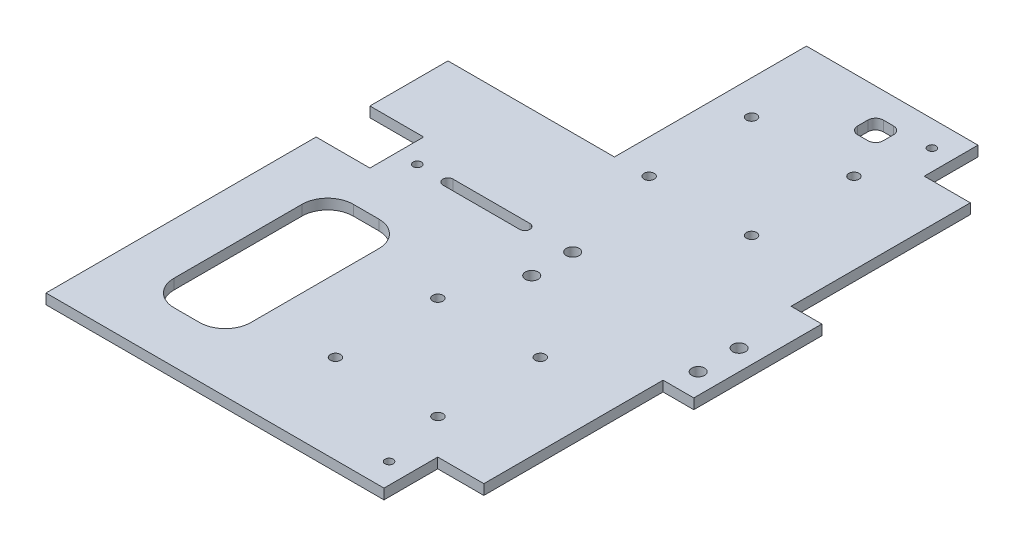
from build123d import *

# Parameters (mm, degrees)
SKETCH1_W           = 162
SKETCH1_H           = 232
BOSS_EXTRUDE1_DEPTH = 4
SKETCH4_W           = 30
SKETCH4_H           = 21
SKETCH4_W_2         = 21
CUT_EXTRUDE3_DEPTH  = 148.108803272
SKETCH5_R           = 1.599999999
SKETCH5_R_2         = 1.600000001
SKETCH5_R_3         = 1.6
SKETCH5_R_4         = 2
CUT_EXTRUDE4_DEPTH  = 148.108803272
SKETCH7_W           = 65
SKETCH7_H           = 75
CUT_EXTRUDE6_DEPTH  = 148.108803272
CUT_EXTRUDE7_DEPTH  = 148.108803272
CUT_EXTRUDE8_DEPTH  = 148.108803272
SKETCH10_R          = 2.5
CUT_EXTRUDE9_DEPTH  = 148.108803272
CUT_EXTRUDE10_DEPTH = 4
SKETCH12_W          = 12
SKETCH12_H          = 70
CUT_EXTRUDE11_DEPTH = 4


with BuildPart() as part:
    # Sketch1 → Boss-Extrude1 (new body)
    with BuildSketch(Plane(origin=(0, 0, 0), x_dir=(1, 0, 0), z_dir=(0, 1, 0))):
        with Locations((4, 4)):
            Rectangle(SKETCH1_W, SKETCH1_H)
    extrude(amount=BOSS_EXTRUDE1_DEPTH)

    # Sketch4 → Cut-Extrude3 (cut, through all)
    with BuildSketch(Plane(origin=(0, 4, 0), x_dir=(1, 0, 0), z_dir=(0, 1, 0))):
        with Locations((70, 109.5)):
            Rectangle(SKETCH4_W, SKETCH4_H)
        with Locations((-66.5, 4)):
            Rectangle(SKETCH4_W_2, SKETCH4_H)
        with Locations((70, -101.5)):
            Rectangle(SKETCH4_W, SKETCH4_H)
    extrude(amount=-CUT_EXTRUDE3_DEPTH, mode=Mode.SUBTRACT)

    # Sketch5 → Cut-Extrude4 (cut, through all)
    with BuildSketch(Plane.XZ):
        with Locations(Location((-48.000025976, -4, 0), (0, 0, 270))):
            Circle(SKETCH5_R)
        with Locations(Location((46.999999998, -109.999999999, 0), (0, 0, 270))):
            Circle(SKETCH5_R_2)
        with Locations(Location((46.999999999, 101.999999999, 0), (0, 0, 270))):
            Circle(SKETCH5_R_3)
        with Locations(Location((41.3, 37.25, 0), (0, 0, 270))):
            Circle(SKETCH5_R_4)
        with Locations(Location((41.3, 77.25, 0), (0, 0, 270))):
            Circle(SKETCH5_R_4)
        with Locations(Location((1.3, 37.25, 0), (0, 0, 270))):
            Circle(SKETCH5_R_4)
        with Locations(Location((1.3, 77.25, 0), (0, 0, 270))):
            Circle(SKETCH5_R_4)
        with Locations(Location((41.3, -45.25, 0), (0, 0, 270))):
            Circle(SKETCH5_R_4)
        with Locations(Location((1.3, -45.25, 0), (0, 0, 270))):
            Circle(SKETCH5_R_4)
        with Locations(Location((1.3, -85.25, 0), (0, 0, 270))):
            Circle(SKETCH5_R_4)
        with Locations(Location((41.3, -85.25, 0), (0, 0, 270))):
            Circle(SKETCH5_R_4)
    extrude(amount=-CUT_EXTRUDE4_DEPTH, mode=Mode.SUBTRACT)

    # Sketch7 → Cut-Extrude6 (cut, through all)
    with BuildSketch(Plane.XZ):
        with Locations((-44.5, -82.5)):
            Rectangle(SKETCH7_W, SKETCH7_H)
    extrude(amount=-CUT_EXTRUDE6_DEPTH, mode=Mode.SUBTRACT)

    # Sketch8 → Cut-Extrude7 (cut, through all)
    with BuildSketch(Plane.XZ):
        with BuildLine():
            Line((-47, 92), (-37, 92))
            ThreePointArc((-37, 92), (-29.928932188, 89.071067812), (-27, 82))
            Line((-27, 82), (-27, 32))
            ThreePointArc((-27, 32), (-29.928932188, 24.928932188), (-37, 22))
            Line((-37, 22), (-47, 22))
            ThreePointArc((-47, 22), (-54.071067812, 24.928932188), (-57, 32))
            Line((-57, 32), (-57, 82))
            ThreePointArc((-57, 82), (-54.071067812, 89.071067812), (-47, 92))
        make_face()
    extrude(amount=-CUT_EXTRUDE7_DEPTH, mode=Mode.SUBTRACT)

    # Sketch9 → Cut-Extrude8 (cut, through all)
    with BuildSketch(Plane(origin=(0, 4, 0), x_dir=(1, 0, 0), z_dir=(0, 1, 0))):
        with BuildLine():
            Line((28, 100), (32, 100))
            ThreePointArc((32, 100), (34.121320344, 100.878679656), (35, 103))
            Line((35, 103), (35, 107))
            ThreePointArc((35, 107), (34.121320344, 109.121320344), (32, 110))
            Line((32, 110), (28, 110))
            ThreePointArc((28, 110), (25.878679656, 109.121320344), (25, 107))
            Line((25, 107), (25, 103))
            ThreePointArc((25, 103), (25.878679656, 100.878679656), (28, 100))
        make_face()
    extrude(amount=-CUT_EXTRUDE8_DEPTH, mode=Mode.SUBTRACT)

    # Sketch10 → Cut-Extrude9 (cut, through all)
    with BuildSketch(Plane(origin=(0, 4, 0), x_dir=(1, 0, 0), z_dir=(0, 1, 0))):
        with Locations(Location((12, -11.291947097, 0), (0, 0, 270))):
            Circle(SKETCH10_R)
        with Locations(Location((12, 4.708052903, 0), (0, 0, 270))):
            Circle(SKETCH10_R)
        with Locations(Location((77, 4.708052903, 0), (0, 0, 270))):
            Circle(SKETCH10_R)
        with Locations(Location((77, -11.291947097, 0), (0, 0, 270))):
            Circle(SKETCH10_R)
    extrude(amount=-CUT_EXTRUDE9_DEPTH, mode=Mode.SUBTRACT)

    # Sketch11 → Cut-Extrude10 (cut)
    with BuildSketch(Plane(origin=(0, 4, 0), x_dir=(1, 0, 0), z_dir=(0, 1, 0))):
        with BuildLine():
            Line((-36, 6), (-6, 6))
            ThreePointArc((-6, 6), (-4, 4), (-6, 2))
            Line((-6, 2), (-36, 2))
            ThreePointArc((-36, 2), (-38, 4), (-36, 6))
        make_face()
    extrude(amount=-CUT_EXTRUDE10_DEPTH, mode=Mode.SUBTRACT)

    # Sketch12 → Cut-Extrude11 (cut)
    with BuildSketch(Plane(origin=(0, 4, 0), x_dir=(1, 0, 0), z_dir=(0, 1, 0))):
        with Locations((79, 64)):
            Rectangle(SKETCH12_W, SKETCH12_H)
        with Locations((79, -56)):
            Rectangle(SKETCH12_W, SKETCH12_H)
    extrude(amount=-CUT_EXTRUDE11_DEPTH, mode=Mode.SUBTRACT)


solid = part.part
